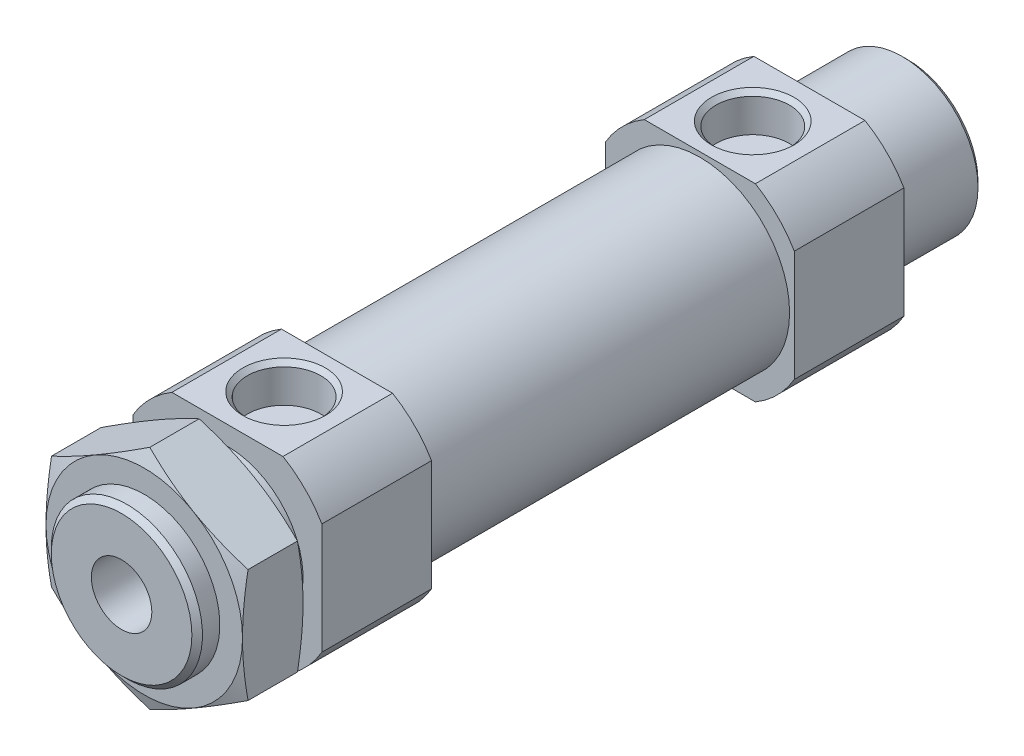
from build123d import *

# Parameters (mm, degrees)
EXTRUDE_START       = 38.5
SKETCH_4_W          = 25
SKETCH_4_H          = 25
EXTRUDE_1_DEPTH     = 14.5
SKETCH_5_R          = 11.875
EXTRUDE_2_DEPTH     = 62.5
SKETCH_6_R          = 10
EXTRUDE_3_DEPTH     = 14
EXTRUDE_START_2     = 49.5
EXTRUDE_4_DEPTH     = 8
SKETCH_8_R          = 4.864
CUT_EXTRUDE_1_DEPTH = 4.994447
SKETCH_9_OUTSIDE_W  = 47.858
SKETCH_9_OUTSIDE_H  = 51.88
SKETCH_9_OUTSIDE_R  = 14.5
CUT_EXTRUDE_2_DEPTH = 77
SKETCH_11_R         = 4
CUT_EXTRUDE_3_DEPTH = 76.5
CHAMFER_1_SIZE      = 0.7
CHAMFER_2_SIZE      = 0.59728
EXTRUDE_START_3     = 13
SKETCH_12_R         = 10
EXTRUDE_5_DEPTH     = 13
CUT_EXTRUDE_START   = 1.3
SKETCH_13_R         = 10
SKETCH_13_R_2       = 9
CUT_EXTRUDE_4_DEPTH = 1.3
CHAMFER_3_SIZE      = 0.7


with BuildPart() as part:
    # 草图4 → 凸台-拉伸1 (new body)
    with BuildSketch(Plane.XY.offset(EXTRUDE_START)):
        Rectangle(SKETCH_4_W, SKETCH_4_H)
    extrude_1 = extrude(amount=-EXTRUDE_1_DEPTH)

    # 草图5 → 凸台-拉伸2 (add)
    with BuildSketch(Plane(origin=(0, 0, 24), x_dir=(-1, 0, 0), z_dir=(0, 0, -1))):
        Circle(SKETCH_5_R)
    extrude(amount=EXTRUDE_2_DEPTH)

    # 镜向1: 凸台-拉伸1 across plane
    add(extrude_1.mirror(Plane.XY))

    # 草图6 → 凸台-拉伸3 (add)
    with BuildSketch(Plane.XY.offset(38.5)):
        with Locations(Location((0, 0, 0), (0, 0, 180))):
            Circle(SKETCH_6_R)
    extrude(amount=EXTRUDE_3_DEPTH)

    # 草图7 → 凸台-拉伸4 (add)
    with BuildSketch(Plane.XY.offset(EXTRUDE_START_2)):
        Polygon((13, 7.505553499), (0, 15.011106999), (-13, 7.505553499), (-13, -7.505553499), (0, -15.011106999), (13, -7.505553499), align=None)
    extrude(amount=-EXTRUDE_4_DEPTH)

    # 草图10 → 切除-旋转1 (revolve, cut)
    with BuildSketch(Plane(origin=(0, 0, 0), x_dir=(1, 0, 0), z_dir=(0, 1, 0)), mode=Mode.PRIVATE) as cut_revolve_1_sk:
        Polygon((-13, -49.5), (-25.989909678, -49.5), (-25.989909678, -41.5), (-13, -41.5), (-23.989909678, -45.5), align=None)
    revolve(cut_revolve_1_sk.sketch.rotate(Axis((0, 0, 52.5), (0, 0, 1)), 180), axis=Axis((0, 0, 52.5), (0, 0, 1)), mode=Mode.SUBTRACT)

    # 草图8 → 切除-拉伸1 (cut)
    with BuildSketch(Plane(origin=(0, 12.5, 0), x_dir=(1, 0, 0), z_dir=(0, 1, 0))):
        with Locations(Location((0, -31, 0), (0, 0, 270))):
            Circle(SKETCH_8_R)
    cut_extrude_1 = extrude(amount=-CUT_EXTRUDE_1_DEPTH, mode=Mode.SUBTRACT)

    # 镜向2: 切除-拉伸1 across plane
    add(cut_extrude_1.mirror(Plane.XY), mode=Mode.SUBTRACT)

    # 草图9 outside → 切除-拉伸2 (cut)
    with BuildSketch(Plane.XY.offset(38.5)):
        Rectangle(SKETCH_9_OUTSIDE_W, SKETCH_9_OUTSIDE_H)
        Circle(SKETCH_9_OUTSIDE_R, mode=Mode.SUBTRACT)
    extrude(amount=-CUT_EXTRUDE_2_DEPTH, mode=Mode.SUBTRACT)

    # 草图11 → 切除-拉伸3 (cut)
    with BuildSketch(Plane.XY.offset(52.5)):
        Circle(SKETCH_11_R)
    extrude(amount=-CUT_EXTRUDE_3_DEPTH, mode=Mode.SUBTRACT)

    # 倒角1
    chamfer_1_edges = [part.edges().sort_by_distance(p)[0] for p in [
        (10, 0, 52.5),
    ]]
    chamfer(chamfer_1_edges, length=CHAMFER_1_SIZE)

    # 倒角2
    chamfer_2_edges = [part.edges().sort_by_distance(p)[0] for p in [
        (0, 12.5, 26.136),
        (0, 12.5, -26.136),
    ]]
    chamfer(chamfer_2_edges, length=CHAMFER_2_SIZE)

    # 草图12 → 凸台-拉伸5 (add)
    with BuildSketch(Plane(origin=(0, 0, -38.5), x_dir=(-1, 0, 0), z_dir=(0, 0, -1)).offset(EXTRUDE_START_3)):
        Circle(SKETCH_12_R)
    extrude(amount=-EXTRUDE_5_DEPTH)

    # 草图13 → 切除-拉伸4 (cut)
    with BuildSketch(Plane(origin=(0, 0, -38.5), x_dir=(-1, 0, 0), z_dir=(0, 0, -1)).offset(CUT_EXTRUDE_START)):
        Circle(SKETCH_13_R)
        Circle(SKETCH_13_R_2, mode=Mode.SUBTRACT)
    extrude(amount=-CUT_EXTRUDE_4_DEPTH, mode=Mode.SUBTRACT)

    # 倒角3
    chamfer_3_edges = [part.edges().sort_by_distance(p)[0] for p in [
        (10, 0, -51.5),
    ]]
    chamfer(chamfer_3_edges, length=CHAMFER_3_SIZE)


solid = part.part
